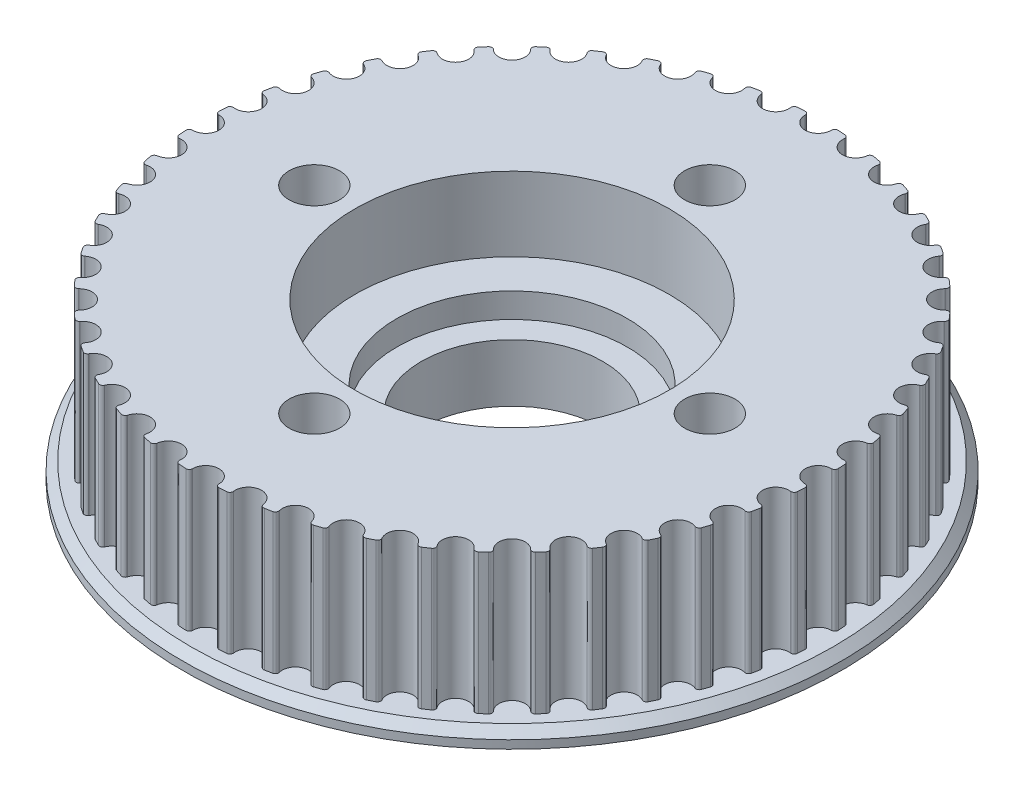
from build123d import *

# Parameters (mm, degrees)
SKETCH4_R               = 37.625
BOSS_EXTRUDE2_DEPTH     = 17
CUT_EXTRUDE5_DEPTH      = 56.85947771
CIRPATTERN1_COUNT       = 48
CUT_EXTRUDE7_DEPTH      = 56.787052735
CUT_EXTRUDE7_DEPTH_BACK = 12
SKETCH8_R               = 19.075
SKETCH9_R               = 11
SKETCH9_R_2             = 3.0625
CUT_EXTRUDE8_DEPTH      = 56.787052735
BOSS_EXTRUDE3_START     = 2
SKETCH10_R              = 40
SKETCH10_R_2            = 3.0625
SKETCH10_R_3            = 11
BOSS_EXTRUDE3_DEPTH     = 2
CHAMFER1_SIZE           = 1
BOSS_EXTRUDE4_START     = 3
SKETCH12_R              = 19.075
SKETCH12_R_2            = 14
BOSS_EXTRUDE4_DEPTH     = 3


with BuildPart() as part:
    # Sketch4 → Boss-Extrude2 (new body)
    with BuildSketch(Plane(origin=(0, 0, 0), x_dir=(1, 0, 0), z_dir=(0, 1, 0))):
        with Locations(Location((0, 0, 0), (0, 0, 270))):
            Circle(SKETCH4_R)
    extrude(amount=BOSS_EXTRUDE2_DEPTH)

    # Sketch5 → Cut-Extrude5 (cut, through all)
    with BuildSketch(Plane(origin=(0, 17, 0), x_dir=(1, 0, 0), z_dir=(0, 1, 0))):
        with BuildLine():
            Line((-1.602617064, 37.216946389), (-1.6, 37.175))
            ThreePointArc((-1.6, 37.175), (0, 35.575), (1.6, 37.175))
            Line((1.6, 37.175), (1.602617064, 37.216946389))
            ThreePointArc((1.602617064, 37.216946389), (1.741925314, 37.476846997), (2.02148735, 37.570656288))
            ThreePointArc((2.02148735, 37.570656288), (2.241178371, 37.558191444), (2.460792737, 37.544441987))
            ThreePointArc((2.460792737, 37.544441987), (0, 37.625), (-2.460792737, 37.544441987))
            ThreePointArc((-2.460792737, 37.544441987), (-2.241178371, 37.558191444), (-2.02148735, 37.570656288))
            ThreePointArc((-2.02148735, 37.570656288), (-1.741925314, 37.476846997), (-1.602617064, 37.216946389))
        make_face()
    cut_extrude5 = extrude(amount=-CUT_EXTRUDE5_DEPTH, mode=Mode.SUBTRACT)

    # CirPattern1: Cut-Extrude5 ×48 about axis
    cirpattern1_axis = Axis((0, 0, 0), (0, 1, 0))
    for i in range(1, CIRPATTERN1_COUNT):
        add(cut_extrude5.rotate(cirpattern1_axis, i * 360 / CIRPATTERN1_COUNT), mode=Mode.SUBTRACT)

    # Sketch8 → Cut-Extrude7 (cut, two sides: drawn at the far end of the back side and taken through both)
    with BuildSketch(Plane(origin=(0, 17, 0), x_dir=(1, 0, 0), z_dir=(0, 1, 0)).offset(-CUT_EXTRUDE7_DEPTH_BACK)):
        with Locations(Location((0, 0, 0), (0, 0, 90))):
            Circle(SKETCH8_R)
    extrude(amount=CUT_EXTRUDE7_DEPTH + CUT_EXTRUDE7_DEPTH_BACK, mode=Mode.SUBTRACT)

    # Sketch9 → Cut-Extrude8 (cut, through all)
    with BuildSketch(Plane.XZ):
        with Locations(Location((0, 0, 0), (0, 0, 270))):
            Circle(SKETCH9_R)
        with Locations(Location((0, 24, 0), (0, 0, 270))):
            Circle(SKETCH9_R_2)
        with Locations(Location((24, 0, 0), (0, 0, 270))):
            Circle(SKETCH9_R_2)
        with Locations(Location((0, -24, 0), (0, 0, 270))):
            Circle(SKETCH9_R_2)
        with Locations(Location((-24, 0, 0), (0, 0, 270))):
            Circle(SKETCH9_R_2)
    extrude(amount=-CUT_EXTRUDE8_DEPTH, mode=Mode.SUBTRACT)

    # Sketch10 → Boss-Extrude3 (add)
    with BuildSketch(Plane.XZ.offset(BOSS_EXTRUDE3_START)):
        with Locations(Location((0, 0, 0), (0, 0, 270))):
            Circle(SKETCH10_R)
        with Locations(Location((0, 24, 0), (0, 0, 270))):
            Circle(SKETCH10_R_2, mode=Mode.SUBTRACT)
        with Locations(Location((24, 0, 0), (0, 0, 270))):
            Circle(SKETCH10_R_2, mode=Mode.SUBTRACT)
        with Locations(Location((-24, 0, 0), (0, 0, 270))):
            Circle(SKETCH10_R_2, mode=Mode.SUBTRACT)
        with Locations(Location((0, -24, 0), (0, 0, 270))):
            Circle(SKETCH10_R_2, mode=Mode.SUBTRACT)
        with Locations(Location((0, 0, 0), (0, 0, 270))):
            Circle(SKETCH10_R_3, mode=Mode.SUBTRACT)
    extrude(amount=-BOSS_EXTRUDE3_DEPTH)

    # Chamfer1
    chamfer1_edges = [part.edges().sort_by_distance(p)[0] for p in [
        (0, 0, 40),
    ]]
    chamfer(chamfer1_edges, length=CHAMFER1_SIZE)

    # Sketch12 → Boss-Extrude4 (add)
    with BuildSketch(Plane(origin=(0, 5, 0), x_dir=(1, 0, 0), z_dir=(0, 1, 0)).offset(BOSS_EXTRUDE4_START)):
        with Locations(Location((0, 0, 0), (0, 0, 90))):
            Circle(SKETCH12_R)
        with Locations(Location((0, 0, 0), (0, 0, 270))):
            Circle(SKETCH12_R_2, mode=Mode.SUBTRACT)
    extrude(amount=-BOSS_EXTRUDE4_DEPTH)


solid = part.part
